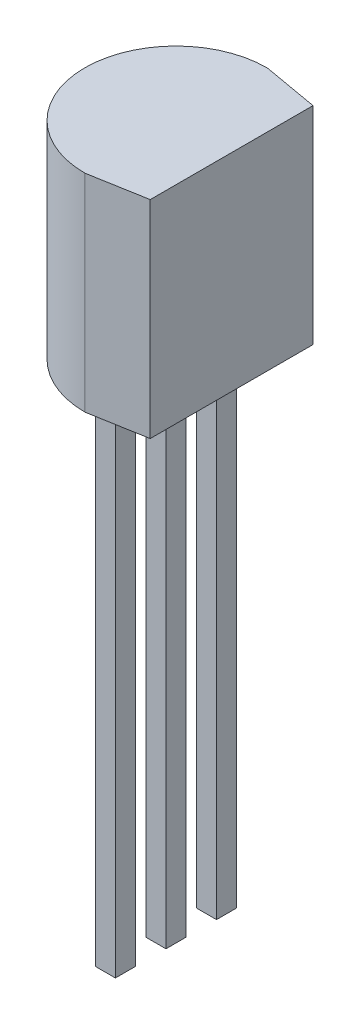
from build123d import *

# Parameters (mm, degrees)
BOSS_EXTRUDE1_DEPTH = 5.2
BOSS_EXTRUDE2_DEPTH = 5.2
SKETCH3_W           = 0.5
SKETCH3_H           = 0.5
BOSS_EXTRUDE3_DEPTH = 12.7


with BuildPart() as part:
    # Sketch1 → Boss-Extrude1 (new body)
    with BuildSketch(Plane(origin=(0, 0, 0), x_dir=(1, 0, 0), z_dir=(0, 1, 0))):
        with BuildLine():
            Line((0, -2.29), (0, 2.29))
            ThreePointArc((0, 2.29), (-2.29, 0), (0, -2.29))
        make_face()
    extrude(amount=BOSS_EXTRUDE1_DEPTH)

    # Sketch1<3> → Boss-Extrude2 (add)
    with BuildSketch(Plane(origin=(0, 0, 0), x_dir=(1, 0, 0), z_dir=(0, 1, 0))):
        Polygon((1.4, 2.044905497), (0.01, 2.29), (0, 2.29), (0, -2.29), (0.01, -2.29), (1.4, -2.044905497), align=None)
    extrude(amount=BOSS_EXTRUDE2_DEPTH)

    # Sketch3 → Boss-Extrude3 (add)
    with BuildSketch(Plane.XZ):
        with Locations((-0.25, 1.27)):
            Rectangle(SKETCH3_W, SKETCH3_H)
        with Locations((-0.25, 0)):
            Rectangle(SKETCH3_W, SKETCH3_H)
        with Locations((-0.25, -1.27)):
            Rectangle(SKETCH3_W, SKETCH3_H)
    extrude(amount=BOSS_EXTRUDE3_DEPTH)


solid = part.part
